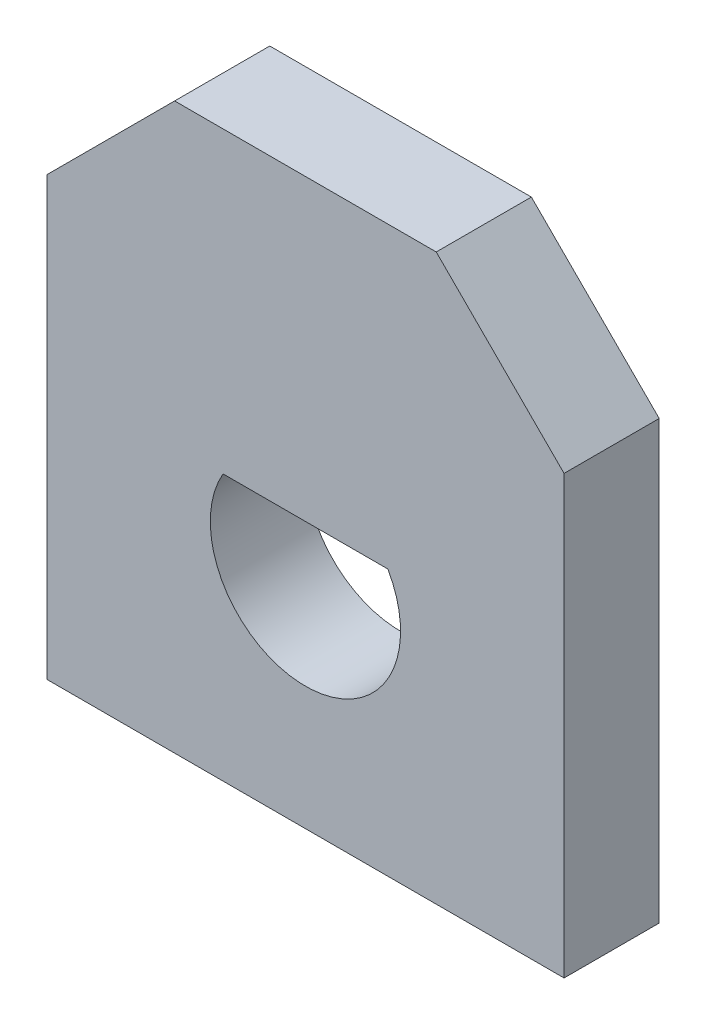
from build123d import *

# Parameters (mm, degrees)
BOSS_EXTRUDE1_DEPTH = 2.032


with BuildPart() as part:
    # Sketch1 → Boss-Extrude1 (new body)
    with BuildSketch(Plane.XY):
        Polygon((2.794, 7.39775), (-2.794, 7.39775), (-5.5245, 4.66725), (-5.5245, -4.66725), (5.5245, -4.66725), (5.5245, 4.66725), align=None)
        with BuildLine():
            ThreePointArc((1.75976362, 1.016), (0, -2.032), (-1.75976362, 1.016))
            Line((-1.75976362, 1.016), (1.75976362, 1.016))
        make_face(mode=Mode.SUBTRACT)
    extrude(amount=BOSS_EXTRUDE1_DEPTH)


solid = part.part
